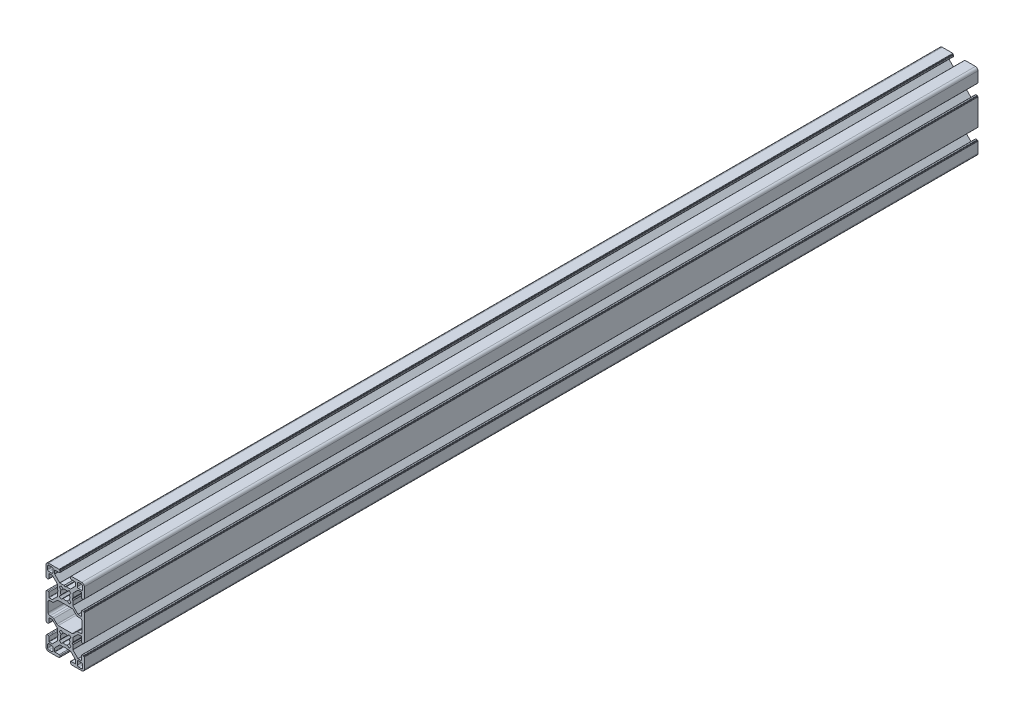
from build123d import *

# Parameters (mm, degrees)
BOSS_EXTRUDE1_DEPTH = 700
SKETCH2_R           = 3
CUT_EXTRUDE1_DEPTH  = 678.163200418
SKETCH3_R           = 3
CUT_EXTRUDE2_DEPTH  = 678.827411761


with BuildPart() as part:
    # Sketch1 → Boss-Extrude1 (new body)
    with BuildSketch(Plane.XY.offset(25)):
        with BuildLine():
            Line((13.400000821, -25.95), (14.300000334, -25.95))
            ThreePointArc((14.300000334, -25.95), (14.44142169, -25.891421356), (14.500000334, -25.75))
            Line((14.500000334, -25.75), (14.500000334, -25.65))
            ThreePointArc((14.500000334, -25.65), (14.558578978, -25.508578644), (14.700000334, -25.45))
            Line((14.700000334, -25.45), (14.8, -25.45))
            ThreePointArc((14.8, -25.45), (14.941421356, -25.391421356), (15, -25.25))
            Line((15, -25.25), (15, -4.75))
            ThreePointArc((15, -4.75), (14.941421356, -4.608578644), (14.8, -4.55))
            Line((14.8, -4.55), (14.700000334, -4.55))
            ThreePointArc((14.700000334, -4.55), (14.558578978, -4.491421356), (14.500000334, -4.35))
            Line((14.500000334, -4.35), (14.500000334, -4.25))
            ThreePointArc((14.500000334, -4.25), (14.44142169, -4.108578644), (14.300000334, -4.05))
            Line((14.300000334, -4.05), (13.400000821, -4.05))
            ThreePointArc((13.400000821, -4.05), (12.975736752, -4.225735931), (12.800000821, -4.65))
            Line((12.800000821, -4.65), (12.800000821, -8.05))
            ThreePointArc((12.800000821, -8.05), (12.741422177, -8.191421356), (12.600000821, -8.25))
            Line((12.600000821, -8.25), (10.132847586, -8.25))
            ThreePointArc((10.132847586, -8.25), (10.056310912, -8.234775911), (9.991426248, -8.191421374))
            Line((9.991426248, -8.191421374), (6.06304592, -4.263042046))
            ThreePointArc((6.06304592, -4.263042046), (6.019691356, -4.19815737), (6.004467258, -4.121620672))
            Line((6.004467258, -4.121620672), (6.004467258, -0.90000009))
            Line((6.004467258, -0.90000009), (5.542586948, -0.099999736))
            ThreePointArc((5.542586948, -0.099999736), (5.515792105, 0), (5.542586948, 0.099999736))
            Line((5.542586948, 0.099999736), (6.004467258, 0.90000009))
            Line((6.004467258, 0.90000009), (6.004467258, 4.121623437))
            ThreePointArc((6.004467258, 4.121623437), (6.019691347, 4.198160112), (6.063045884, 4.263044775))
            Line((6.063045884, 4.263044775), (9.991421447, 8.191421338))
            ThreePointArc((9.991421447, 8.191421338), (10.056306123, 8.234775902), (10.132842821, 8.25))
            Line((10.132842821, 8.25), (12.600000821, 8.25))
            ThreePointArc((12.600000821, 8.25), (12.741422177, 8.191421356), (12.800000821, 8.05))
            Line((12.800000821, 8.05), (12.800000821, 4.65))
            ThreePointArc((12.800000821, 4.65), (12.975736752, 4.225735931), (13.400000821, 4.05))
            Line((13.400000821, 4.05), (14.300000334, 4.05))
            ThreePointArc((14.300000334, 4.05), (14.44142169, 4.108578644), (14.500000334, 4.25))
            Line((14.500000334, 4.25), (14.500000334, 4.350000125))
            ThreePointArc((14.500000334, 4.350000125), (14.558578978, 4.491421481), (14.700000334, 4.550000125))
            Line((14.700000334, 4.550000125), (14.8, 4.550000125))
            ThreePointArc((14.8, 4.550000125), (14.941421356, 4.608578769), (15, 4.750000125))
            Line((15, 4.750000125), (15, 13))
            ThreePointArc((15, 13), (14.414213562, 14.414213562), (13, 15))
            Line((13, 15), (4.75, 15))
            ThreePointArc((4.75, 15), (4.608578644, 14.941421356), (4.55, 14.8))
            Line((4.55, 14.8), (4.55, 14.7))
            ThreePointArc((4.55, 14.7), (4.491421356, 14.558578644), (4.35, 14.5))
            Line((4.35, 14.5), (4.25, 14.5))
            ThreePointArc((4.25, 14.5), (4.108578644, 14.441421356), (4.05, 14.3))
            Line((4.05, 14.3), (4.05, 13.4))
            ThreePointArc((4.05, 13.4), (4.225735931, 12.975735931), (4.65, 12.8))
            Line((4.65, 12.8), (8.05, 12.8))
            ThreePointArc((8.05, 12.8), (8.191421356, 12.741421356), (8.25, 12.6))
            Line((8.25, 12.6), (8.25, 10.132847492))
            ThreePointArc((8.25, 10.132847492), (8.234775904, 10.056310778), (8.191421344, 9.991426082))
            Line((8.191421344, 9.991426082), (4.258574852, 6.058578588))
            ThreePointArc((4.258574852, 6.058578588), (4.193690258, 6.015224079), (4.117153656, 6))
            Line((4.117153656, 6), (0.899999648, 6))
            Line((0.899999648, 6), (0.101934004, 5.53923672))
            ThreePointArc((0.101934004, 5.53923672), (0, 5.511923593), (-0.101934004, 5.53923672))
            Line((-0.101934004, 5.53923672), (-0.899999648, 6))
            Line((-0.899999648, 6), (-4.117156145, 6))
            ThreePointArc((-4.117156145, 6), (-4.193692724, 6.015224069), (-4.258577305, 6.058578552))
            Line((-4.258577305, 6.058578552), (-8.191421308, 9.991421554))
            ThreePointArc((-8.191421308, 9.991421554), (-8.234775894, 10.056306263), (-8.25, 10.132843))
            Line((-8.25, 10.132843), (-8.25, 12.6))
            ThreePointArc((-8.25, 12.6), (-8.191421356, 12.741421356), (-8.05, 12.8))
            Line((-8.05, 12.8), (-4.65, 12.8))
            ThreePointArc((-4.65, 12.8), (-4.225735931, 12.975735931), (-4.05, 13.4))
            Line((-4.05, 13.4), (-4.05, 14.3))
            ThreePointArc((-4.05, 14.3), (-4.108578644, 14.441421356), (-4.25, 14.5))
            Line((-4.25, 14.5), (-4.35, 14.5))
            ThreePointArc((-4.35, 14.5), (-4.491421356, 14.558578644), (-4.55, 14.7))
            Line((-4.55, 14.7), (-4.55, 14.8))
            ThreePointArc((-4.55, 14.8), (-4.608578644, 14.941421356), (-4.75, 15))
            Line((-4.75, 15), (-13, 15))
            ThreePointArc((-13, 15), (-14.414213562, 14.414213562), (-15, 13))
            Line((-15, 13), (-15, 4.750000125))
            ThreePointArc((-15, 4.750000125), (-14.941421356, 4.608578769), (-14.8, 4.550000125))
            Line((-14.8, 4.550000125), (-14.700000334, 4.550000125))
            ThreePointArc((-14.700000334, 4.550000125), (-14.558578978, 4.491421481), (-14.500000334, 4.350000125))
            Line((-14.500000334, 4.350000125), (-14.500000334, 4.25))
            ThreePointArc((-14.500000334, 4.25), (-14.44142169, 4.108578644), (-14.300000334, 4.05))
            Line((-14.300000334, 4.05), (-13.400000821, 4.05))
            ThreePointArc((-13.400000821, 4.05), (-12.975736752, 4.225735931), (-12.800000821, 4.65))
            Line((-12.800000821, 4.65), (-12.800000821, 8.05))
            ThreePointArc((-12.800000821, 8.05), (-12.741422177, 8.191421356), (-12.600000821, 8.25))
            Line((-12.600000821, 8.25), (-10.132842821, 8.25))
            ThreePointArc((-10.132842821, 8.25), (-10.056306123, 8.234775902), (-9.991421447, 8.191421338))
            Line((-9.991421447, 8.191421338), (-6.063045884, 4.263044775))
            ThreePointArc((-6.063045884, 4.263044775), (-6.019691347, 4.198160112), (-6.004467258, 4.121623437))
            Line((-6.004467258, 4.121623437), (-6.004467258, 0.90000009))
            Line((-6.004467258, 0.90000009), (-5.542586948, 0.099999736))
            ThreePointArc((-5.542586948, 0.099999736), (-5.515792105, 0), (-5.542586948, -0.099999736))
            Line((-5.542586948, -0.099999736), (-6.004467258, -0.90000009))
            Line((-6.004467258, -0.90000009), (-6.004467258, -4.121623437))
            ThreePointArc((-6.004467258, -4.121623437), (-6.019691347, -4.198160112), (-6.063045884, -4.263044775))
            Line((-6.063045884, -4.263044775), (-9.991421447, -8.191421338))
            ThreePointArc((-9.991421447, -8.191421338), (-10.056306123, -8.234775902), (-10.132842821, -8.25))
            Line((-10.132842821, -8.25), (-12.600000821, -8.25))
            ThreePointArc((-12.600000821, -8.25), (-12.741422177, -8.191421356), (-12.800000821, -8.05))
            Line((-12.800000821, -8.05), (-12.800000821, -4.65))
            ThreePointArc((-12.800000821, -4.65), (-12.975736752, -4.225735931), (-13.400000821, -4.05))
            Line((-13.400000821, -4.05), (-14.300000334, -4.05))
            ThreePointArc((-14.300000334, -4.05), (-14.44142169, -4.108578644), (-14.500000334, -4.25))
            Line((-14.500000334, -4.25), (-14.500000334, -4.35))
            ThreePointArc((-14.500000334, -4.35), (-14.558578978, -4.491421356), (-14.700000334, -4.55))
            Line((-14.700000334, -4.55), (-14.8, -4.55))
            ThreePointArc((-14.8, -4.55), (-14.941421356, -4.608578644), (-15, -4.75))
            Line((-15, -4.75), (-15, -25.25))
            ThreePointArc((-15, -25.25), (-14.941421356, -25.391421356), (-14.8, -25.45))
            Line((-14.8, -25.45), (-14.700000334, -25.45))
            ThreePointArc((-14.700000334, -25.45), (-14.558578978, -25.508578644), (-14.500000334, -25.65))
            Line((-14.500000334, -25.65), (-14.500000334, -25.75))
            ThreePointArc((-14.500000334, -25.75), (-14.44142169, -25.891421356), (-14.300000334, -25.95))
            Line((-14.300000334, -25.95), (-13.400000821, -25.95))
            ThreePointArc((-13.400000821, -25.95), (-12.975736752, -25.774264069), (-12.800000821, -25.35))
            Line((-12.800000821, -25.35), (-12.800000821, -21.95))
            ThreePointArc((-12.800000821, -21.95), (-12.741422177, -21.808578644), (-12.600000821, -21.75))
            Line((-12.600000821, -21.75), (-10.132842821, -21.75))
            ThreePointArc((-10.132842821, -21.75), (-10.056306123, -21.765224098), (-9.991421447, -21.808578662))
            Line((-9.991421447, -21.808578662), (-6.063045884, -25.736955225))
            ThreePointArc((-6.063045884, -25.736955225), (-6.019691347, -25.801839888), (-6.004467258, -25.878376563))
            Line((-6.004467258, -25.878376563), (-6.004467258, -29.09999991))
            Line((-6.004467258, -29.09999991), (-5.542586948, -29.900000264))
            ThreePointArc((-5.542586948, -29.900000264), (-5.515792105, -30), (-5.542586948, -30.099999736))
            Line((-5.542586948, -30.099999736), (-6.004467258, -30.90000009))
            Line((-6.004467258, -30.90000009), (-6.004467258, -34.121623437))
            ThreePointArc((-6.004467258, -34.121623437), (-6.019691347, -34.198160112), (-6.063045884, -34.263044775))
            Line((-6.063045884, -34.263044775), (-9.991421447, -38.191421338))
            ThreePointArc((-9.991421447, -38.191421338), (-10.056306123, -38.234775902), (-10.132842821, -38.25))
            Line((-10.132842821, -38.25), (-12.600000821, -38.25))
            ThreePointArc((-12.600000821, -38.25), (-12.741422177, -38.191421356), (-12.800000821, -38.05))
            Line((-12.800000821, -38.05), (-12.800000821, -34.65))
            ThreePointArc((-12.800000821, -34.65), (-12.975736752, -34.225735931), (-13.400000821, -34.05))
            Line((-13.400000821, -34.05), (-14.300000334, -34.05))
            ThreePointArc((-14.300000334, -34.05), (-14.44142169, -34.108578644), (-14.500000334, -34.25))
            Line((-14.500000334, -34.25), (-14.500000334, -34.350000125))
            ThreePointArc((-14.500000334, -34.350000125), (-14.558578978, -34.491421481), (-14.700000334, -34.550000125))
            Line((-14.700000334, -34.550000125), (-14.8, -34.550000125))
            ThreePointArc((-14.8, -34.550000125), (-14.941421356, -34.608578769), (-15, -34.750000125))
            Line((-15, -34.750000125), (-15, -43))
            ThreePointArc((-15, -43), (-14.414213562, -44.414213562), (-13, -45))
            Line((-13, -45), (-4.75, -45))
            ThreePointArc((-4.75, -45), (-4.608578644, -44.941421356), (-4.55, -44.8))
            Line((-4.55, -44.8), (-4.55, -44.7))
            ThreePointArc((-4.55, -44.7), (-4.491421356, -44.558578644), (-4.35, -44.5))
            Line((-4.35, -44.5), (-4.25, -44.5))
            ThreePointArc((-4.25, -44.5), (-4.108578644, -44.441421356), (-4.05, -44.3))
            Line((-4.05, -44.3), (-4.05, -43.4))
            ThreePointArc((-4.05, -43.4), (-4.225735931, -42.975735931), (-4.65, -42.8))
            Line((-4.65, -42.8), (-8.05, -42.8))
            ThreePointArc((-8.05, -42.8), (-8.191421356, -42.741421356), (-8.25, -42.6))
            Line((-8.25, -42.6), (-8.25, -40.132843))
            ThreePointArc((-8.25, -40.132843), (-8.234775894, -40.056306263), (-8.191421308, -39.991421554))
            Line((-8.191421308, -39.991421554), (-4.258577305, -36.058578552))
            ThreePointArc((-4.258577305, -36.058578552), (-4.193692724, -36.015224069), (-4.117156145, -36))
            Line((-4.117156145, -36), (-0.899999648, -36))
            Line((-0.899999648, -36), (-0.101934004, -35.53923672))
            ThreePointArc((-0.101934004, -35.53923672), (0, -35.511923593), (0.101934004, -35.53923672))
            Line((0.101934004, -35.53923672), (0.899999648, -36))
            Line((0.899999648, -36), (4.117153656, -36))
            ThreePointArc((4.117153656, -36), (4.193690258, -36.015224079), (4.258574852, -36.058578588))
            Line((4.258574852, -36.058578588), (8.191421344, -39.991426082))
            ThreePointArc((8.191421344, -39.991426082), (8.234775904, -40.056310778), (8.25, -40.132847492))
            Line((8.25, -40.132847492), (8.25, -42.6))
            ThreePointArc((8.25, -42.6), (8.191421356, -42.741421356), (8.05, -42.8))
            Line((8.05, -42.8), (4.65, -42.8))
            ThreePointArc((4.65, -42.8), (4.225735931, -42.975735931), (4.05, -43.4))
            Line((4.05, -43.4), (4.05, -44.3))
            ThreePointArc((4.05, -44.3), (4.108578644, -44.441421356), (4.25, -44.5))
            Line((4.25, -44.5), (4.35, -44.5))
            ThreePointArc((4.35, -44.5), (4.491421356, -44.558578644), (4.55, -44.7))
            Line((4.55, -44.7), (4.55, -44.8))
            ThreePointArc((4.55, -44.8), (4.608578644, -44.941421356), (4.75, -45))
            Line((4.75, -45), (13, -45))
            ThreePointArc((13, -45), (14.414213562, -44.414213562), (15, -43))
            Line((15, -43), (15, -34.750000125))
            ThreePointArc((15, -34.750000125), (14.941421356, -34.608578769), (14.8, -34.550000125))
            Line((14.8, -34.550000125), (14.700000334, -34.550000125))
            ThreePointArc((14.700000334, -34.550000125), (14.558578978, -34.491421481), (14.500000334, -34.350000125))
            Line((14.500000334, -34.350000125), (14.500000334, -34.25))
            ThreePointArc((14.500000334, -34.25), (14.44142169, -34.108578644), (14.300000334, -34.05))
            Line((14.300000334, -34.05), (13.400000821, -34.05))
            ThreePointArc((13.400000821, -34.05), (12.975736752, -34.225735931), (12.800000821, -34.65))
            Line((12.800000821, -34.65), (12.800000821, -38.05))
            ThreePointArc((12.800000821, -38.05), (12.741422177, -38.191421356), (12.600000821, -38.25))
            Line((12.600000821, -38.25), (10.132842821, -38.25))
            ThreePointArc((10.132842821, -38.25), (10.056306123, -38.234775902), (9.991421447, -38.191421338))
            Line((9.991421447, -38.191421338), (6.063045884, -34.263044775))
            ThreePointArc((6.063045884, -34.263044775), (6.019691347, -34.198160112), (6.004467258, -34.121623437))
            Line((6.004467258, -34.121623437), (6.004467258, -30.90000009))
            Line((6.004467258, -30.90000009), (5.542586948, -30.099999736))
            ThreePointArc((5.542586948, -30.099999736), (5.515792105, -30), (5.542586948, -29.900000264))
            Line((5.542586948, -29.900000264), (6.004467258, -29.09999991))
            Line((6.004467258, -29.09999991), (6.004467258, -25.878379328))
            ThreePointArc((6.004467258, -25.878379328), (6.019691356, -25.80184263), (6.06304592, -25.736957954))
            Line((6.06304592, -25.736957954), (9.991426248, -21.808578626))
            ThreePointArc((9.991426248, -21.808578626), (10.056310912, -21.765224089), (10.132847586, -21.75))
            Line((10.132847586, -21.75), (12.600000821, -21.75))
            ThreePointArc((12.600000821, -21.75), (12.741422177, -21.808578644), (12.800000821, -21.95))
            Line((12.800000821, -21.95), (12.800000821, -25.35))
            ThreePointArc((12.800000821, -25.35), (12.975736752, -25.774264069), (13.400000821, -25.95))
        make_face()
        with BuildLine():
            Line((-9.500000904, 12.700000174), (-9.500000904, 10.500000174))
            ThreePointArc((-9.500000904, 10.500000174), (-9.792894123, 9.792893393), (-10.500000904, 9.500000174))
            Line((-10.500000904, 9.500000174), (-12.700000904, 9.500000174))
            ThreePointArc((-12.700000904, 9.500000174), (-13.407107685, 9.792893393), (-13.700000904, 10.500000174))
            Line((-13.700000904, 10.500000174), (-13.700000904, 12.700000174))
            ThreePointArc((-13.700000904, 12.700000174), (-13.407107685, 13.407106955), (-12.700000904, 13.700000174))
            Line((-12.700000904, 13.700000174), (-10.500000904, 13.700000174))
            ThreePointArc((-10.500000904, 13.700000174), (-9.792894123, 13.407106955), (-9.500000904, 12.700000174))
        make_face(mode=Mode.SUBTRACT)
        with BuildLine():
            Line((12.700000904, 9.500000174), (10.500000904, 9.500000174))
            ThreePointArc((10.500000904, 9.500000174), (9.792894123, 9.792893393), (9.500000904, 10.500000174))
            Line((9.500000904, 10.500000174), (9.500000904, 12.700000174))
            ThreePointArc((9.500000904, 12.700000174), (9.792894123, 13.407106955), (10.500000904, 13.700000174))
            Line((10.500000904, 13.700000174), (12.700000904, 13.700000174))
            ThreePointArc((12.700000904, 13.700000174), (13.407107685, 13.407106955), (13.700000904, 12.700000174))
            Line((13.700000904, 12.700000174), (13.700000904, 10.500000174))
            ThreePointArc((13.700000904, 10.500000174), (13.407107685, 9.792893393), (12.700000904, 9.500000174))
        make_face(mode=Mode.SUBTRACT)
        with BuildLine():
            Line((-12.700000904, -39.500000174), (-10.500000904, -39.500000174))
            ThreePointArc((-10.500000904, -39.500000174), (-9.792894123, -39.792893393), (-9.500000904, -40.500000174))
            Line((-9.500000904, -40.500000174), (-9.500000904, -42.700000174))
            ThreePointArc((-9.500000904, -42.700000174), (-9.792894123, -43.407106955), (-10.500000904, -43.700000174))
            Line((-10.500000904, -43.700000174), (-12.700000904, -43.700000174))
            ThreePointArc((-12.700000904, -43.700000174), (-13.407107685, -43.407106955), (-13.700000904, -42.700000174))
            Line((-13.700000904, -42.700000174), (-13.700000904, -40.500000174))
            ThreePointArc((-13.700000904, -40.500000174), (-13.407107685, -39.792893393), (-12.700000904, -39.500000174))
        make_face(mode=Mode.SUBTRACT)
        with BuildLine():
            Line((9.500000904, -42.700000174), (9.500000904, -40.500000174))
            ThreePointArc((9.500000904, -40.500000174), (9.792894123, -39.792893393), (10.500000904, -39.500000174))
            Line((10.500000904, -39.500000174), (12.700000904, -39.500000174))
            ThreePointArc((12.700000904, -39.500000174), (13.407107685, -39.792893393), (13.700000904, -40.500000174))
            Line((13.700000904, -40.500000174), (13.700000904, -42.700000174))
            ThreePointArc((13.700000904, -42.700000174), (13.407107685, -43.407106955), (12.700000904, -43.700000174))
            Line((12.700000904, -43.700000174), (10.500000904, -43.700000174))
            ThreePointArc((10.500000904, -43.700000174), (9.792894123, -43.407106955), (9.500000904, -42.700000174))
        make_face(mode=Mode.SUBTRACT)
        with BuildLine():
            Line((-3.28056155, 1.600129968), (-4.518401855, 3.135928041))
            ThreePointArc((-4.518401855, 3.135928041), (-3.897156783, 3.881001031), (-3.154670945, 4.505335862))
            Line((-3.154670945, 4.505335862), (-1.600130621, 3.280561232))
            ThreePointArc((-1.600130621, 3.280561232), (0, 3.65), (1.600130621, 3.280561232))
            Line((1.600130621, 3.280561232), (3.154670945, 4.505335862))
            ThreePointArc((3.154670945, 4.505335862), (3.897156783, 3.881001031), (4.518401855, 3.135928041))
            Line((4.518401855, 3.135928041), (3.28056155, 1.600129968))
            ThreePointArc((3.28056155, 1.600129968), (3.65, 0), (3.28056155, -1.600129968))
            Line((3.28056155, -1.600129968), (4.518401855, -3.135928041))
            ThreePointArc((4.518401855, -3.135928041), (3.897156783, -3.881001031), (3.154670945, -4.505335862))
            Line((3.154670945, -4.505335862), (1.600130621, -3.280561232))
            ThreePointArc((1.600130621, -3.280561232), (0, -3.65), (-1.600130621, -3.280561232))
            Line((-1.600130621, -3.280561232), (-3.154670945, -4.505335862))
            ThreePointArc((-3.154670945, -4.505335862), (-3.897156783, -3.881001031), (-4.518401855, -3.135928041))
            Line((-4.518401855, -3.135928041), (-3.28056155, -1.600129968))
            ThreePointArc((-3.28056155, -1.600129968), (-3.65, 0), (-3.28056155, 1.600129968))
        make_face(mode=Mode.SUBTRACT)
        with BuildLine():
            Line((-4.518401855, -33.135928041), (-3.28056155, -31.600129968))
            ThreePointArc((-3.28056155, -31.600129968), (-3.65, -30), (-3.28056155, -28.399870032))
            Line((-3.28056155, -28.399870032), (-4.518401855, -26.864071959))
            ThreePointArc((-4.518401855, -26.864071959), (-3.897156783, -26.118998969), (-3.154670945, -25.494664138))
            Line((-3.154670945, -25.494664138), (-1.600130621, -26.719438768))
            ThreePointArc((-1.600130621, -26.719438768), (0, -26.35), (1.600130621, -26.719438768))
            Line((1.600130621, -26.719438768), (3.154670945, -25.494664138))
            ThreePointArc((3.154670945, -25.494664138), (3.897156783, -26.118998969), (4.518401855, -26.864071959))
            Line((4.518401855, -26.864071959), (3.28056155, -28.399870032))
            ThreePointArc((3.28056155, -28.399870032), (3.65, -30), (3.28056155, -31.600129968))
            Line((3.28056155, -31.600129968), (4.518401855, -33.135928041))
            ThreePointArc((4.518401855, -33.135928041), (3.897156783, -33.881001031), (3.154670945, -34.505335862))
            Line((3.154670945, -34.505335862), (1.600130621, -33.280561232))
            ThreePointArc((1.600130621, -33.280561232), (0, -33.65), (-1.600130621, -33.280561232))
            Line((-1.600130621, -33.280561232), (-3.154670945, -34.505335862))
            ThreePointArc((-3.154670945, -34.505335862), (-3.897156783, -33.881001031), (-4.518401855, -33.135928041))
        make_face(mode=Mode.SUBTRACT)
        with BuildLine():
            Line((8.927207746, -20.539339865), (6.410354062, -23.056193892))
            ThreePointArc((6.410354062, -23.056193892), (5.923719014, -23.381353072), (5.349693818, -23.495533793))
            Line((5.349693818, -23.495533793), (-5.349693818, -23.495533793))
            ThreePointArc((-5.349693818, -23.495533793), (-5.923719014, -23.381353072), (-6.410354062, -23.056193892))
            Line((-6.410354062, -23.056193892), (-8.927207746, -20.539339865))
            ThreePointArc((-8.927207746, -20.539339865), (-9.413842755, -20.214180712), (-9.987867904, -20.1))
            Line((-9.987867904, -20.1), (-11.849999904, -20.1))
            ThreePointArc((-11.849999904, -20.1), (-12.910660076, -19.660660172), (-13.349999904, -18.6))
            Line((-13.349999904, -18.6), (-13.349999904, -11.4))
            ThreePointArc((-13.349999904, -11.4), (-12.910660076, -10.339339828), (-11.849999904, -9.9))
            Line((-11.849999904, -9.9), (-9.987867904, -9.9))
            ThreePointArc((-9.987867904, -9.9), (-9.413842755, -9.785819288), (-8.927207746, -9.460660135))
            Line((-8.927207746, -9.460660135), (-6.410354062, -6.943806108))
            ThreePointArc((-6.410354062, -6.943806108), (-5.923719014, -6.618646928), (-5.349693818, -6.504466207))
            Line((-5.349693818, -6.504466207), (5.349693818, -6.504466207))
            ThreePointArc((5.349693818, -6.504466207), (5.923719014, -6.618646928), (6.410354062, -6.943806108))
            Line((6.410354062, -6.943806108), (8.927207746, -9.460660135))
            ThreePointArc((8.927207746, -9.460660135), (9.413842755, -9.785819288), (9.987867904, -9.9))
            Line((9.987867904, -9.9), (11.849999904, -9.9))
            ThreePointArc((11.849999904, -9.9), (12.910660076, -10.339339828), (13.349999904, -11.4))
            Line((13.349999904, -11.4), (13.349999904, -18.6))
            ThreePointArc((13.349999904, -18.6), (12.910660076, -19.660660172), (11.849999904, -20.1))
            Line((11.849999904, -20.1), (9.987867904, -20.1))
            ThreePointArc((9.987867904, -20.1), (9.413842755, -20.214180712), (8.927207746, -20.539339865))
        make_face(mode=Mode.SUBTRACT)
    extrude(amount=-BOSS_EXTRUDE1_DEPTH)

    # Sketch2 → Cut-Extrude1 (cut, through all)
    with BuildSketch(Plane(origin=(15, 0, 0), x_dir=(0, 0, -1), z_dir=(1, 0, 0))):
        with Locations(Location((30, -30, 0), (0, 0, 1.910208136))):
            Circle(SKETCH2_R)
    extrude(amount=-CUT_EXTRUDE1_DEPTH, mode=Mode.SUBTRACT)

    # Sketch3 → Cut-Extrude2 (cut, through all)
    with BuildSketch(Plane.XZ.offset(45)):
        with Locations(Location((0, -75, 0), (0, 0, 302.233899395))):
            Circle(SKETCH3_R)
        with Locations(Location((0, -595, 0), (0, 0, 302.233899395))):
            Circle(SKETCH3_R)
    extrude(amount=-CUT_EXTRUDE2_DEPTH, mode=Mode.SUBTRACT)


solid = part.part
